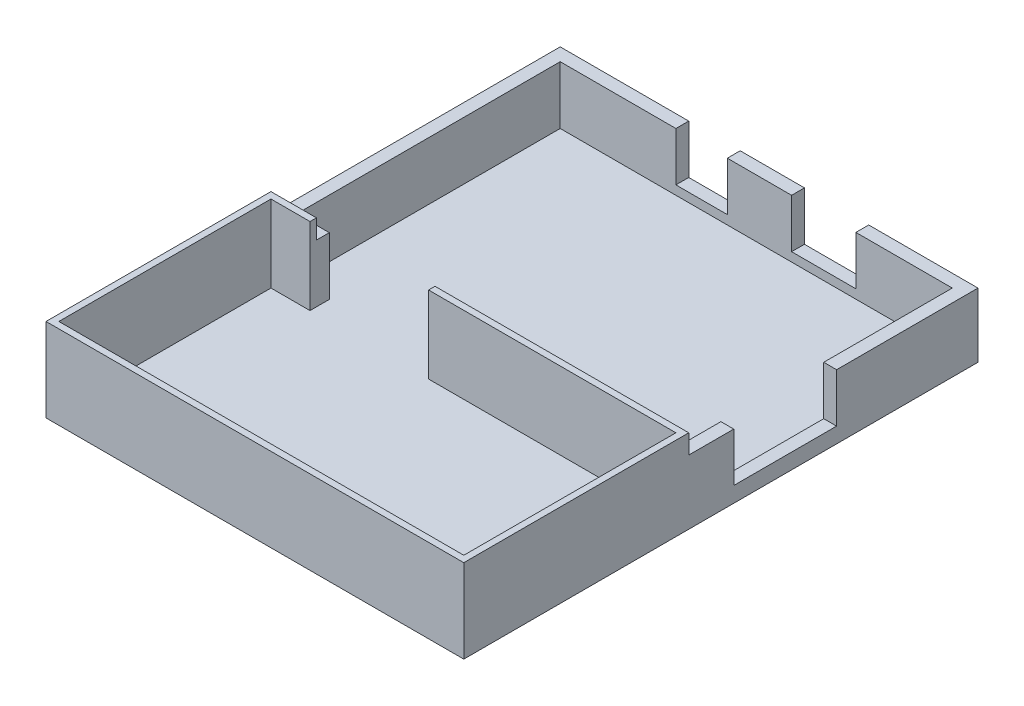
from build123d import *

# Parameters (mm, degrees)
SKETCH1_W           = 61
SKETCH1_H           = 41
BOSS_EXTRUDE1_DEPTH = 1
SKETCH2_W           = 65
SKETCH2_H           = 45
SKETCH2_W_2         = 61
SKETCH2_H_2         = 41
BOSS_EXTRUDE2_DEPTH = 10
SKETCH3_W           = 8
SKETCH3_H           = 2
SKETCH3_W_2         = 10
SKETCH3_W_3         = 2
SKETCH3_H_2         = 16
CUT_EXTRUDE1_DEPTH  = 7.6
SKETCH4_W           = 65
SKETCH4_H           = 1
BOSS_EXTRUDE3_DEPTH = 35
SKETCH5_W           = 65
SKETCH5_H           = 35
SKETCH5_W_2         = 63
SKETCH5_H_2         = 33
BOSS_EXTRUDE4_DEPTH = 12
CUT_EXTRUDE2_REACH  = 69.316
SKETCH6_W           = 18.450763423
SKETCH6_H           = 7.617543819


with BuildPart() as part:
    # Sketch1 → Boss-Extrude1 (new body)
    with BuildSketch(Plane(origin=(0, 0, 0), x_dir=(1, 0, 0), z_dir=(0, 1, 0))):
        Rectangle(SKETCH1_W, SKETCH1_H)
    extrude(amount=BOSS_EXTRUDE1_DEPTH)

    # Sketch2 → Boss-Extrude2 (add)
    with BuildSketch(Plane.XZ):
        Rectangle(SKETCH2_W, SKETCH2_H)
        Rectangle(SKETCH2_W_2, SKETCH2_H_2, mode=Mode.SUBTRACT)
    extrude(amount=-BOSS_EXTRUDE2_DEPTH)

    # Sketch3 → Cut-Extrude1 (cut)
    with BuildSketch(Plane(origin=(0, 10, 0), x_dir=(1, 0, 0), z_dir=(0, 1, 0))):
        with Locations((-8.5, 21.5)):
            Rectangle(SKETCH3_W, SKETCH3_H)
        with Locations((10.5, 21.5)):
            Rectangle(SKETCH3_W_2, SKETCH3_H)
        with Locations((31.5, -7.5)):
            Rectangle(SKETCH3_W_3, SKETCH3_H_2)
    extrude(amount=-CUT_EXTRUDE1_DEPTH, mode=Mode.SUBTRACT)

    # Sketch4 → Boss-Extrude3 (add)
    with BuildSketch(Plane.XY.offset(22.5)):
        with Locations((0, 0.5)):
            Rectangle(SKETCH4_W, SKETCH4_H)
    extrude(amount=BOSS_EXTRUDE3_DEPTH)

    # Sketch5 → Boss-Extrude4 (add)
    with BuildSketch(Plane(origin=(0, 1, 0), x_dir=(1, 0, 0), z_dir=(0, 1, 0))):
        with Locations((0, -40)):
            Rectangle(SKETCH5_W, SKETCH5_H)
        with Locations((0, -40)):
            Rectangle(SKETCH5_W_2, SKETCH5_H_2, mode=Mode.SUBTRACT)
    extrude(amount=BOSS_EXTRUDE4_DEPTH)

    # Cut-Extrude2: up to this face of the body (flat: up to its plane)
    cut_extrude2_end = Plane(part.part.faces().sort_by_distance((0, 1, 40))[0])
    # Sketch6 → Cut-Extrude2 (cut, up to the picked face)
    with BuildSketch(Plane(origin=(0, 13, 0), x_dir=(1, 0, 0), z_dir=(0, 1, 0)), mode=Mode.PRIVATE) as cut_extrude2_sk1:
        with Locations((-16.202920441, -19.691228091)):
            Rectangle(SKETCH6_W, SKETCH6_H)
    cut_extrude2_tool1 = split(extrude(cut_extrude2_sk1.sketch, amount=-CUT_EXTRUDE2_REACH, mode=Mode.PRIVATE), bisect_by=cut_extrude2_end, keep=Keep.BOTH, mode=Mode.PRIVATE)
    add(cut_extrude2_tool1.solids().sort_by(Axis((-16.20292, 13, 19.691228), (0, -1, 0)))[0], mode=Mode.SUBTRACT)


solid = part.part
